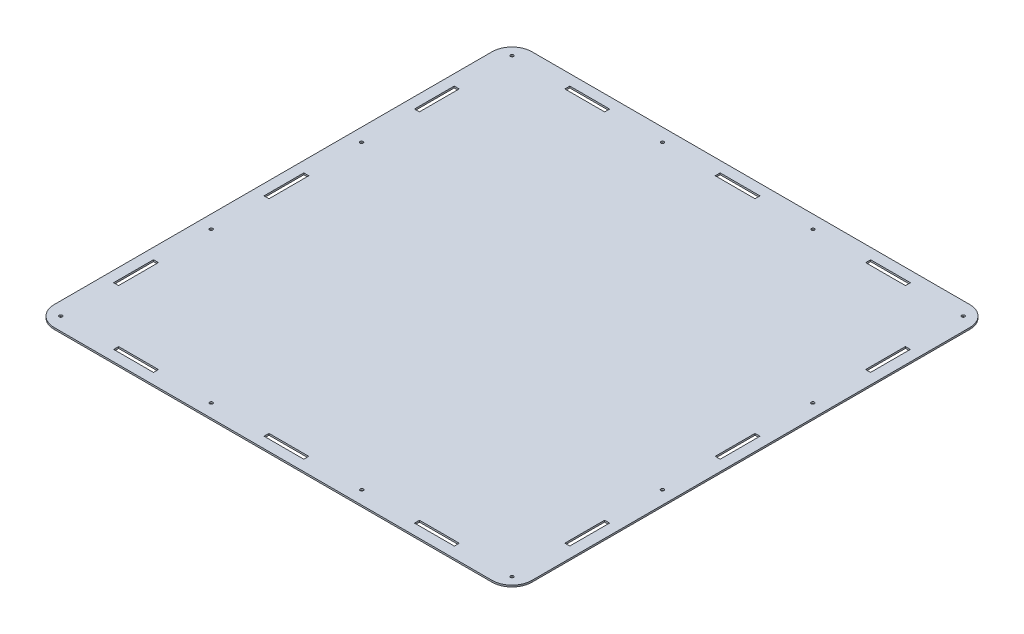
from build123d import *

# Parameters (mm, degrees)
SKETCH1_W           = 457.2
SKETCH1_H           = 457.2
BOSS_EXTRUDE1_DEPTH = 1.5875
SKETCH2_W           = 4.7625
SKETCH2_H           = 38.1
SKETCH2_W_2         = 38.1
SKETCH2_H_2         = 4.7625
CUT_EXTRUDE2_DEPTH  = 1.5875
SKETCH3_R           = 1.48828125
CUT_EXTRUDE3_DEPTH  = 1.5875
FILLET1_R           = 19.05


with BuildPart() as part:
    # Sketch1 → Boss-Extrude1 (new body)
    with BuildSketch(Plane(origin=(0, 0, 0), x_dir=(1, 0, 0), z_dir=(0, 1, 0))):
        Rectangle(SKETCH1_W, SKETCH1_H)
    extrude(amount=BOSS_EXTRUDE1_DEPTH)

    # Sketch2 → Cut-Extrude2 (cut)
    with BuildSketch(Plane(origin=(0, 1.5875, 0), x_dir=(1, 0, 0), z_dir=(0, 1, 0))):
        with Locations((-215.9, -143.933333333)):
            Rectangle(SKETCH2_W, SKETCH2_H)
        with Locations((-215.9, 0)):
            Rectangle(SKETCH2_W, SKETCH2_H)
        with Locations((-215.9, 143.933333333)):
            Rectangle(SKETCH2_W, SKETCH2_H)
        with Locations((215.9, -143.933333333)):
            Rectangle(SKETCH2_W, SKETCH2_H)
        with Locations((215.9, 0)):
            Rectangle(SKETCH2_W, SKETCH2_H)
        with Locations((215.9, 143.933333333)):
            Rectangle(SKETCH2_W, SKETCH2_H)
        with Locations((144.018, 215.9)):
            Rectangle(SKETCH2_W_2, SKETCH2_H_2)
        with Locations((0, 215.9)):
            Rectangle(SKETCH2_W_2, SKETCH2_H_2)
        with Locations((-143.891, 215.9)):
            Rectangle(SKETCH2_W_2, SKETCH2_H_2)
        with Locations((144.018, -215.9)):
            Rectangle(SKETCH2_W_2, SKETCH2_H_2)
        with Locations((-143.891, -215.9)):
            Rectangle(SKETCH2_W_2, SKETCH2_H_2)
        with Locations((0, -215.9)):
            Rectangle(SKETCH2_W_2, SKETCH2_H_2)
    extrude(amount=-CUT_EXTRUDE2_DEPTH, mode=Mode.SUBTRACT)

    # Sketch3 → Cut-Extrude3 (cut)
    with BuildSketch(Plane(origin=(0, 1.5875, 0), x_dir=(1, 0, 0), z_dir=(0, 1, 0))):
        with Locations(Location((-71.882, 215.9, 0), (0, 0, 270))):
            Circle(SKETCH3_R)
        with Locations(Location((72.136, 215.9, 0), (0, 0, 270))):
            Circle(SKETCH3_R)
        with Locations(Location((215.9, 215.9, 0), (0, 0, 270))):
            Circle(SKETCH3_R)
        with Locations(Location((215.9, 71.966666667, 0), (0, 0, 270))):
            Circle(SKETCH3_R)
        with Locations(Location((215.9, -71.966666667, 0), (0, 0, 270))):
            Circle(SKETCH3_R)
        with Locations(Location((215.9, -215.9, 0), (0, 0, 270))):
            Circle(SKETCH3_R)
        with Locations(Location((72.136, -215.9, 0), (0, 0, 270))):
            Circle(SKETCH3_R)
        with Locations(Location((-71.882, -215.9, 0), (0, 0, 270))):
            Circle(SKETCH3_R)
        with Locations(Location((-215.9, -215.9, 0), (0, 0, 270))):
            Circle(SKETCH3_R)
        with Locations(Location((-215.9, -71.966666667, 0), (0, 0, 270))):
            Circle(SKETCH3_R)
        with Locations(Location((-215.9, 71.966666667, 0), (0, 0, 270))):
            Circle(SKETCH3_R)
        with Locations(Location((-215.9, 215.9, 0), (0, 0, 270))):
            Circle(SKETCH3_R)
    extrude(amount=-CUT_EXTRUDE3_DEPTH, mode=Mode.SUBTRACT)

    # Fillet1
    fillet1_edges = [part.edges().sort_by_distance(p)[0] for p in [
        (-228.6, 0.79375, -228.6),
        (228.6, 0.79375, -228.6),
        (228.6, 0.79375, 228.6),
        (-228.6, 0.79375, 228.6),
    ]]
    fillet(fillet1_edges, radius=FILLET1_R)


solid = part.part
